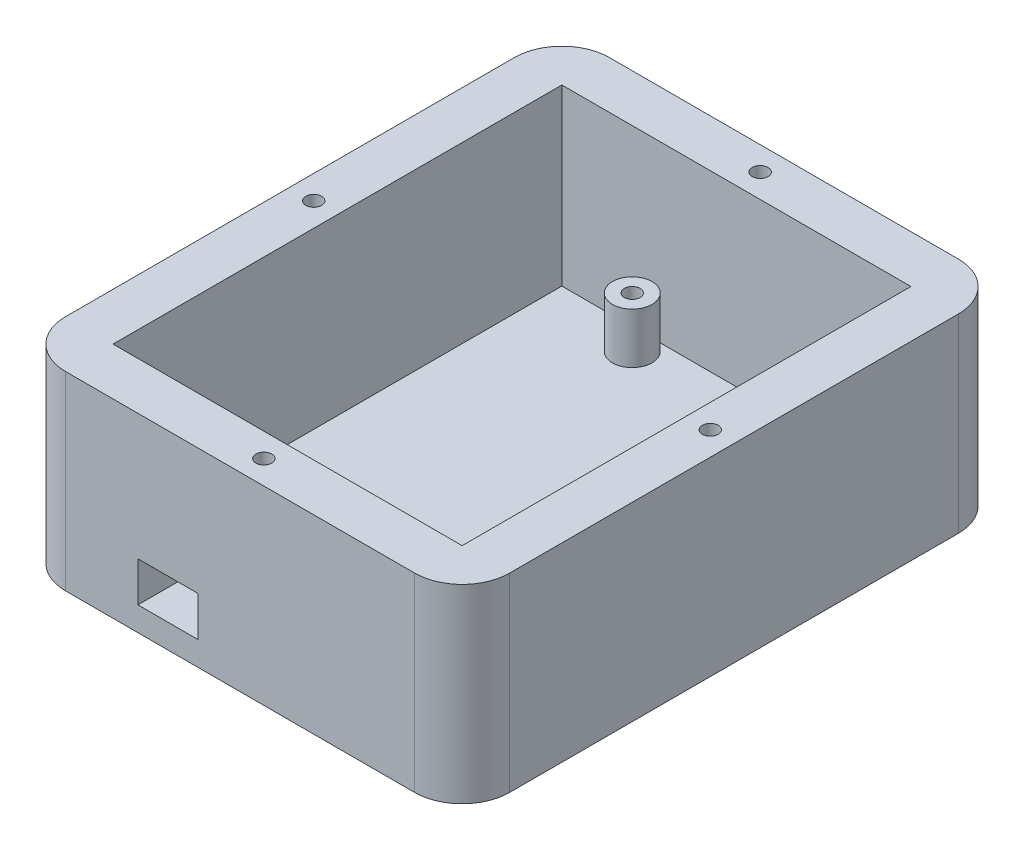
from build123d import *

# Parameters (mm, degrees)
BOSS_EXTRUDE1_DEPTH = 38.1
SKETCH2_W           = 69.999999954
SKETCH2_H           = 90.000000086
CUT_EXTRUDE1_DEPTH  = 34.925
SKETCH3_R           = 3.96875
SKETCH3_R_2         = 1.5875
BOSS_EXTRUDE2_DEPTH = 10.16
BOSS_EXTRUDE3_DEPTH = 38.1
SKETCH5_R           = 1.5875
CUT_EXTRUDE2_DEPTH  = 12.7
SKETCH7_W           = 12
SKETCH7_H           = 8
CUT_EXTRUDE3_DEPTH  = 9.525


with BuildPart() as part:
    # Sketch1 → Boss-Extrude1 (new body)
    with BuildSketch(Plane(origin=(0, 0, 0), x_dir=(1, 0, 0), z_dir=(0, 1, 0))):
        with BuildLine():
            Line((3.175, 0), (73.174999954, 0))
            ThreePointArc((73.174999954, 0), (75.420063984, 0.92993597), (76.349999954, 3.175))
            Line((76.349999954, 3.175), (76.349999954, 93.175000086))
            ThreePointArc((76.349999954, 93.175000086), (75.420063984, 95.420064116), (73.174999954, 96.350000086))
            Line((73.174999954, 96.350000086), (3.175, 96.350000086))
            ThreePointArc((3.175, 96.350000086), (0.92993597, 95.420064116), (0, 93.175000086))
            Line((0, 93.175000086), (0, 3.175))
            ThreePointArc((0, 3.175), (0.92993597, 0.92993597), (3.175, 0))
        make_face()
    extrude(amount=BOSS_EXTRUDE1_DEPTH)

    # Sketch2 → Cut-Extrude1 (cut)
    with BuildSketch(Plane(origin=(0, 38.1, 0), x_dir=(1, 0, 0), z_dir=(0, 1, 0))):
        with Locations((38.174999977, 48.175000043)):
            Rectangle(SKETCH2_W, SKETCH2_H)
    extrude(amount=-CUT_EXTRUDE1_DEPTH, mode=Mode.SUBTRACT)

    # Sketch3 → Boss-Extrude2 (add)
    # profile 1 of 2: a face of its own
    with BuildSketch(Plane(origin=(0, 3.175, 0), x_dir=(1, 0, 0), z_dir=(0, 1, 0))):
        with Locations(Location((21.587999977, 88.875000043, 0), (0, 0, 90))):
            Circle(SKETCH3_R)
        with Locations(Location((21.587999977, 88.875000043, 0), (0, 0, 270))):
            Circle(SKETCH3_R_2, mode=Mode.SUBTRACT)
    # profile 2 of 2: a face of its own
    with BuildSketch(Plane(origin=(0, 3.175, 0), x_dir=(1, 0, 0), z_dir=(0, 1, 0))):
        with Locations(Location((39.987999977, 9.175000043, 0), (0, 0, 90))):
            Circle(SKETCH3_R)
        with Locations(Location((39.987999977, 9.175000043, 0), (0, 0, 270))):
            Circle(SKETCH3_R_2, mode=Mode.SUBTRACT)
    extrude(amount=BOSS_EXTRUDE2_DEPTH)

    # Sketch4 → Boss-Extrude3 (add)
    with BuildSketch(Plane.XZ):
        with BuildLine():
            Line((-6.35, -3.175), (-6.35, -93.175000086))
            ThreePointArc((-6.35, -93.175000086), (-3.560192091, -99.910192177), (3.175, -102.700000086))
            Line((3.175, -102.700000086), (73.174999954, -102.700000086))
            ThreePointArc((73.174999954, -102.700000086), (79.910192045, -99.910192177), (82.699999954, -93.175000086))
            Line((82.699999954, -93.175000086), (82.699999954, -3.175))
            ThreePointArc((82.699999954, -3.175), (79.910192045, 3.560192091), (73.174999954, 6.35))
            Line((73.174999954, 6.35), (3.175, 6.35))
            ThreePointArc((3.175, 6.35), (-3.560192091, 3.560192091), (-6.35, -3.175))
        make_face()
        with BuildLine():
            Line((0, -3.175), (0, -93.175000086))
            ThreePointArc((0, -93.175000086), (0.92993597, -95.420064116), (3.175, -96.350000086))
            Line((3.175, -96.350000086), (73.174999954, -96.350000086))
            ThreePointArc((73.174999954, -96.350000086), (75.420063984, -95.420064116), (76.349999954, -93.175000086))
            Line((76.349999954, -93.175000086), (76.349999954, -3.175))
            ThreePointArc((76.349999954, -3.175), (75.420063984, -0.92993597), (73.174999954, 0))
            Line((73.174999954, 0), (3.175, 0))
            ThreePointArc((3.175, 0), (0.92993597, -0.92993597), (0, -3.175))
        make_face(mode=Mode.SUBTRACT)
    extrude(amount=-BOSS_EXTRUDE3_DEPTH)

    # Sketch5 → Cut-Extrude2 (cut)
    with BuildSketch(Plane(origin=(0, 38.1, 0), x_dir=(1, 0, 0), z_dir=(0, 1, 0))):
        with Locations(Location((-1.5875, 48.175000043, 0), (0, 0, 270))):
            Circle(SKETCH5_R)
        with Locations(Location((38.174999977, 97.937500086, 0), (0, 0, 270))):
            Circle(SKETCH5_R)
        with Locations(Location((38.174999977, -1.5875, 0), (0, 0, 90))):
            Circle(SKETCH5_R)
        with Locations(Location((77.937499954, 48.175000043, 0), (0, 0, 90))):
            Circle(SKETCH5_R)
    extrude(amount=-CUT_EXTRUDE2_DEPTH, mode=Mode.SUBTRACT)

    # Sketch7 → Cut-Extrude3 (cut)
    with BuildSketch(Plane.XY.offset(6.35)):
        with Locations((23.687999977, 8.835)):
            Rectangle(SKETCH7_W, SKETCH7_H)
    extrude(amount=-CUT_EXTRUDE3_DEPTH, mode=Mode.SUBTRACT)


solid = part.part
